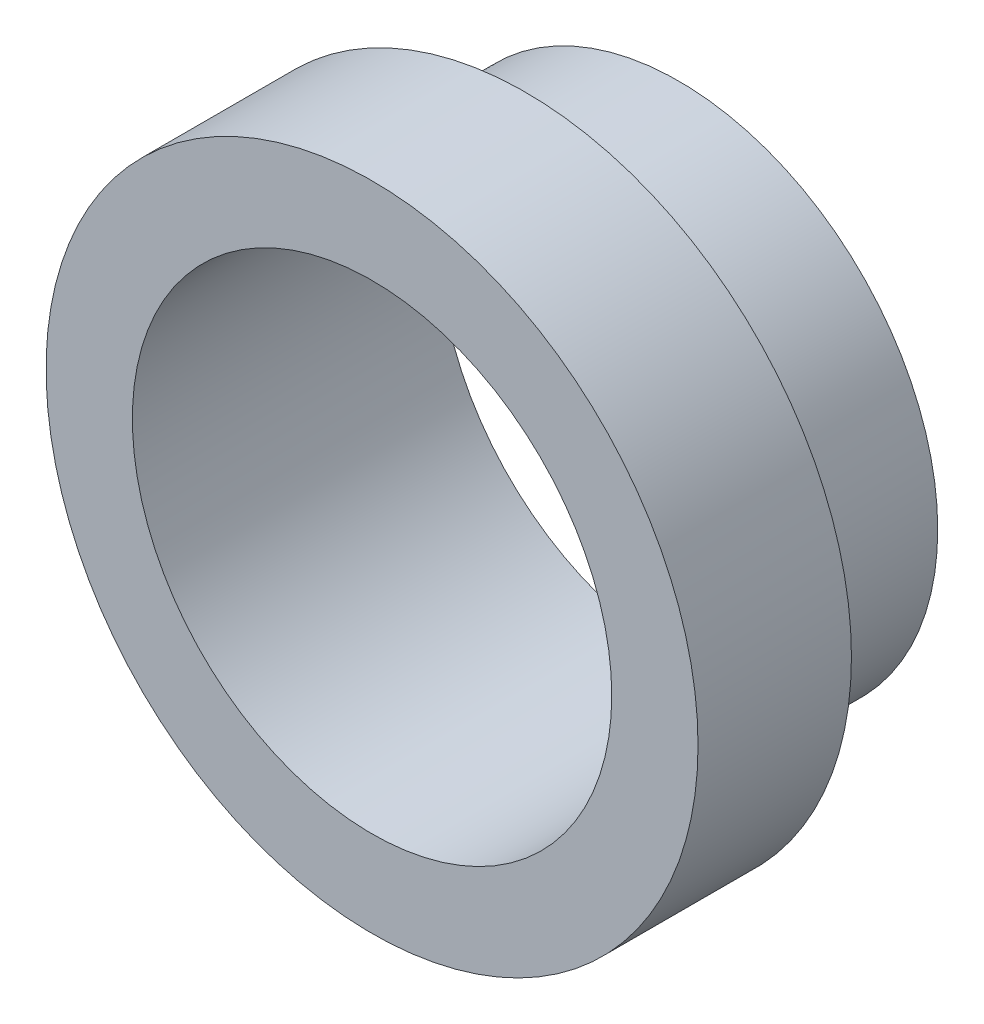
from build123d import *

# Parameters (mm, degrees)
NEEDLE_NECK_START      = 47.5
SKETCH_1_R             = 13.5
SKETCH_1_R_2           = 12.5
NEEDLE_NECK_DEPTH      = 8
NEEDLE_OUTER_HUB_START = 55.5
SKETCH_2_R             = 17
SKETCH_2_R_2           = 12.5
NEEDLE_OUTER_HUB_DEPTH = 8


with BuildPart() as part:
    # Эскиз1 → Needle_neck (new body)
    with BuildSketch(Plane.XY.offset(NEEDLE_NECK_START)):
        Circle(SKETCH_1_R)
        Circle(SKETCH_1_R_2, mode=Mode.SUBTRACT)
    extrude(amount=NEEDLE_NECK_DEPTH)

    # Эскиз2 → Needle_outer_hub (add)
    with BuildSketch(Plane.XY.offset(NEEDLE_OUTER_HUB_START)):
        Circle(SKETCH_2_R)
        Circle(SKETCH_2_R_2, mode=Mode.SUBTRACT)
    extrude(amount=NEEDLE_OUTER_HUB_DEPTH)


solid = part.part
